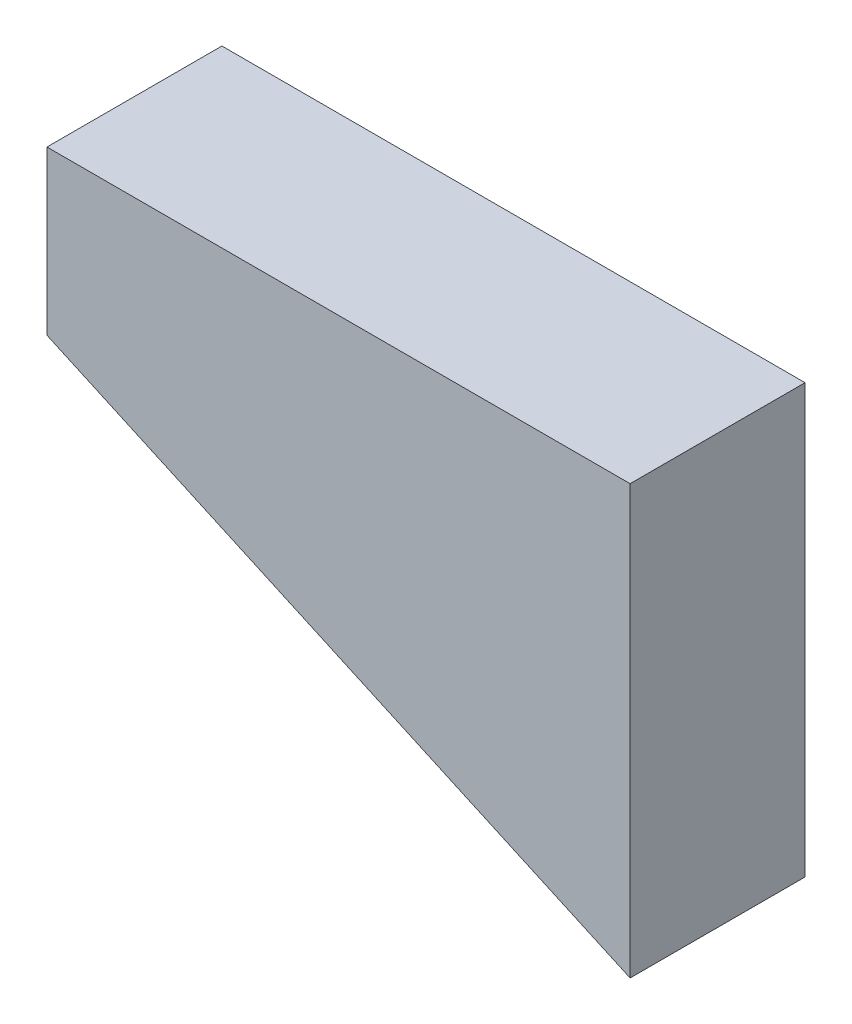
from build123d import *

# Parameters (mm, degrees)
BOSS_EXTRUDE1_DEPTH = 19.05


with BuildPart() as part:
    # Sketch1 → Boss-Extrude1 (new body)
    with BuildSketch(Plane.XY):
        Polygon((-673.68449825, 1780.446787186), (-673.68449825, 1733.829526185), (-737.18449825, 1762.693162548), (-737.18449825, 1780.446787186), align=None)
    extrude(amount=BOSS_EXTRUDE1_DEPTH)


solid = part.part
